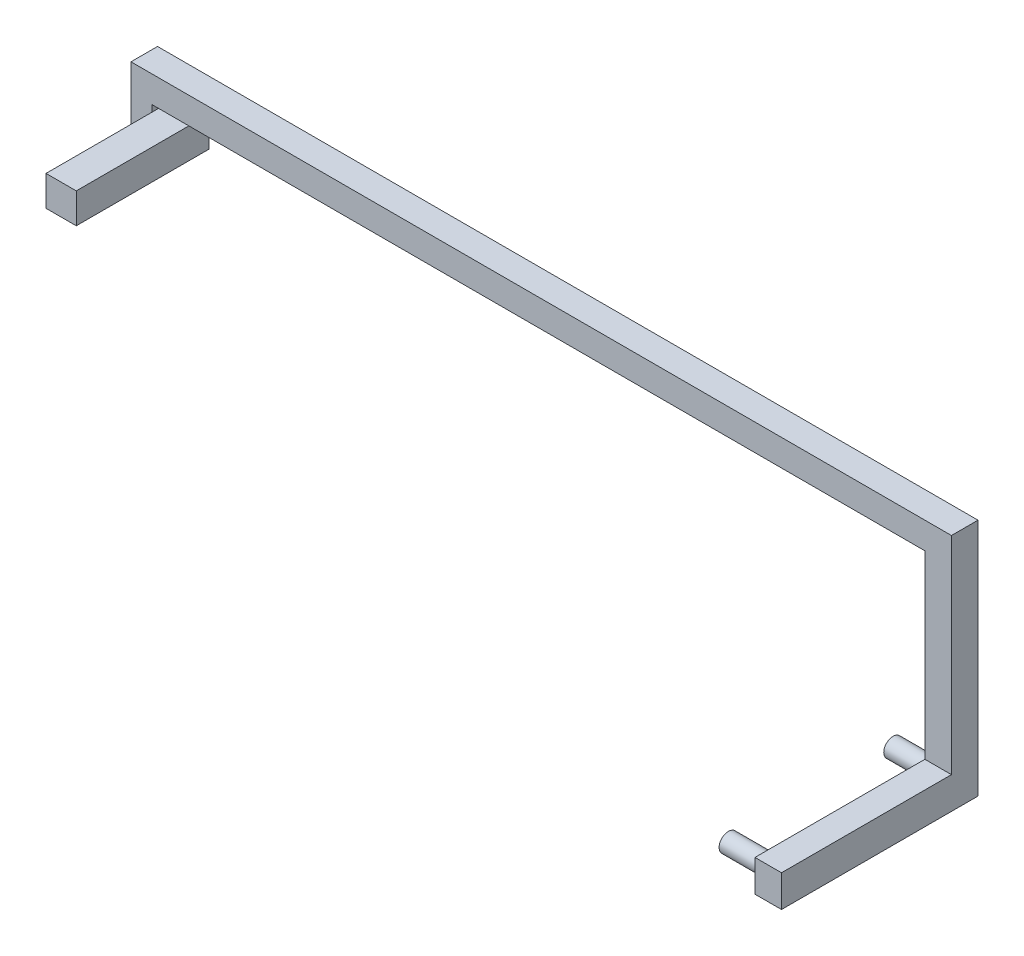
from build123d import *

# Parameters (mm, degrees)
BOSS_EXTRUDE1_DEPTH = 5
SKETCH2_W           = 5.7
SKETCH2_H           = 5.7
BOSS_EXTRUDE2_DEPTH = 20
SKETCH3_W           = 5
SKETCH3_H           = 6
BOSS_EXTRUDE3_DEPTH = 32
SKETCH4_R           = 1.75
BOSS_EXTRUDE4_DEPTH = 8


with BuildPart() as part:
    # Sketch1 → Boss-Extrude1 (new body)
    with BuildSketch(Plane.XY):
        Polygon((0, 5.7), (0, 6.9), (5.5, 6.9), (145.5, 6.9), (145.5, -33.1), (150.5, -33.1), (150.5, 6.9), (150.5, 11.9), (5.5, 11.9), (-4, 11.9), (-4, 0), (0, 0), (5.7, 0), (5.7, 5.7), align=None)
    extrude(amount=BOSS_EXTRUDE1_DEPTH)

    # Sketch2 → Boss-Extrude2 (add)
    with BuildSketch(Plane.XY.offset(5)):
        with Locations((2.85, 2.85)):
            Rectangle(SKETCH2_W, SKETCH2_H)
    extrude(amount=BOSS_EXTRUDE2_DEPTH)

    # Sketch3 → Boss-Extrude3 (add)
    with BuildSketch(Plane.XY.offset(5)):
        with Locations((148, -30.1)):
            Rectangle(SKETCH3_W, SKETCH3_H)
    extrude(amount=BOSS_EXTRUDE3_DEPTH)

    # Sketch4 → Boss-Extrude4 (add)
    with BuildSketch(Plane.ZY.offset(-145.5)):
        with Locations(Location((3, -30.1, 0), (0, 0, 180))):
            Circle(SKETCH4_R)
        with Locations(Location((34, -30.1, 0), (0, 0, 180))):
            Circle(SKETCH4_R)
    extrude(amount=BOSS_EXTRUDE4_DEPTH)


solid = part.part
